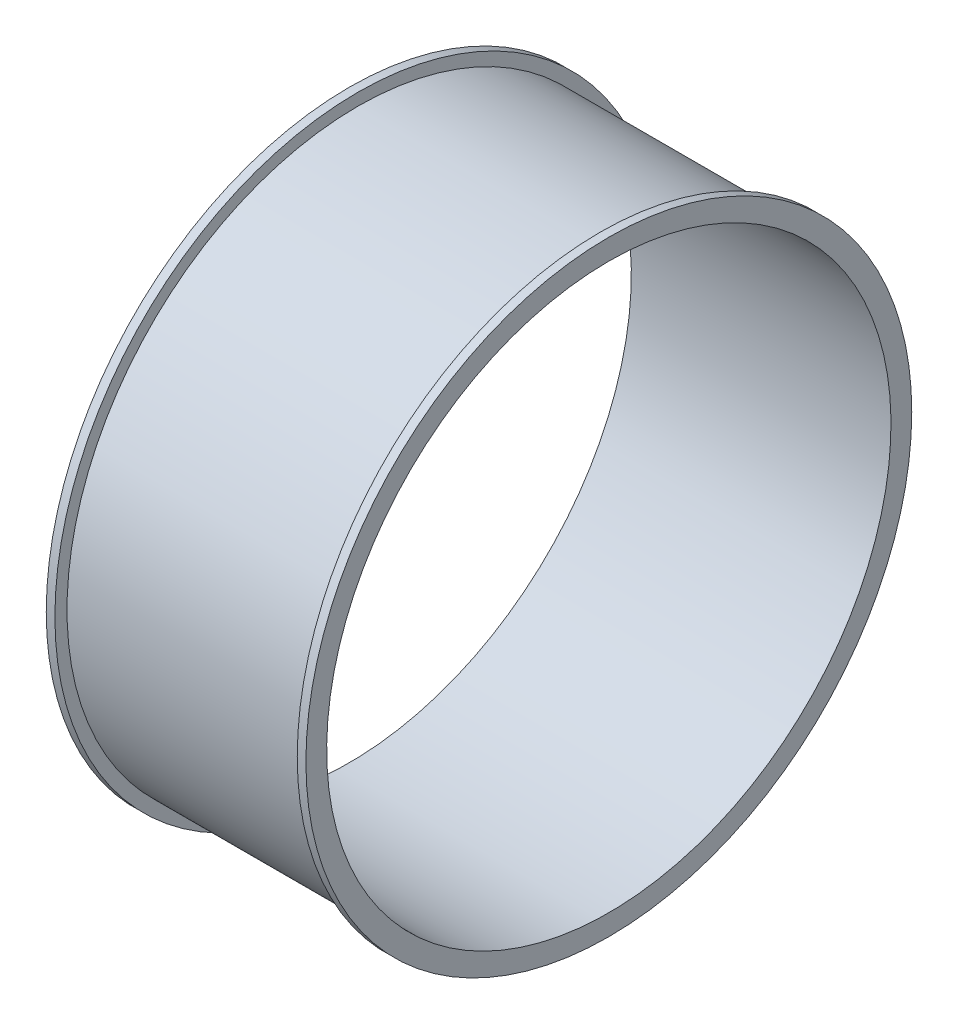
from build123d import *

# Parameters (mm, degrees)
REVOLVE1_ANGLE = 359.999999589


with BuildPart() as part:
    # Sketch1 → Revolve1 (revolve)
    with BuildSketch(Plane.XY):
        Polygon((700, 1630), (700, 1750), (750, 1750), (750, 1680), (2150, 1680), (2150, 1750), (2200, 1750), (2200, 1630), align=None)
    revolve(axis=Axis((0, 0, 0), (1, 0, 0)), revolution_arc=REVOLVE1_ANGLE)


solid = part.part
